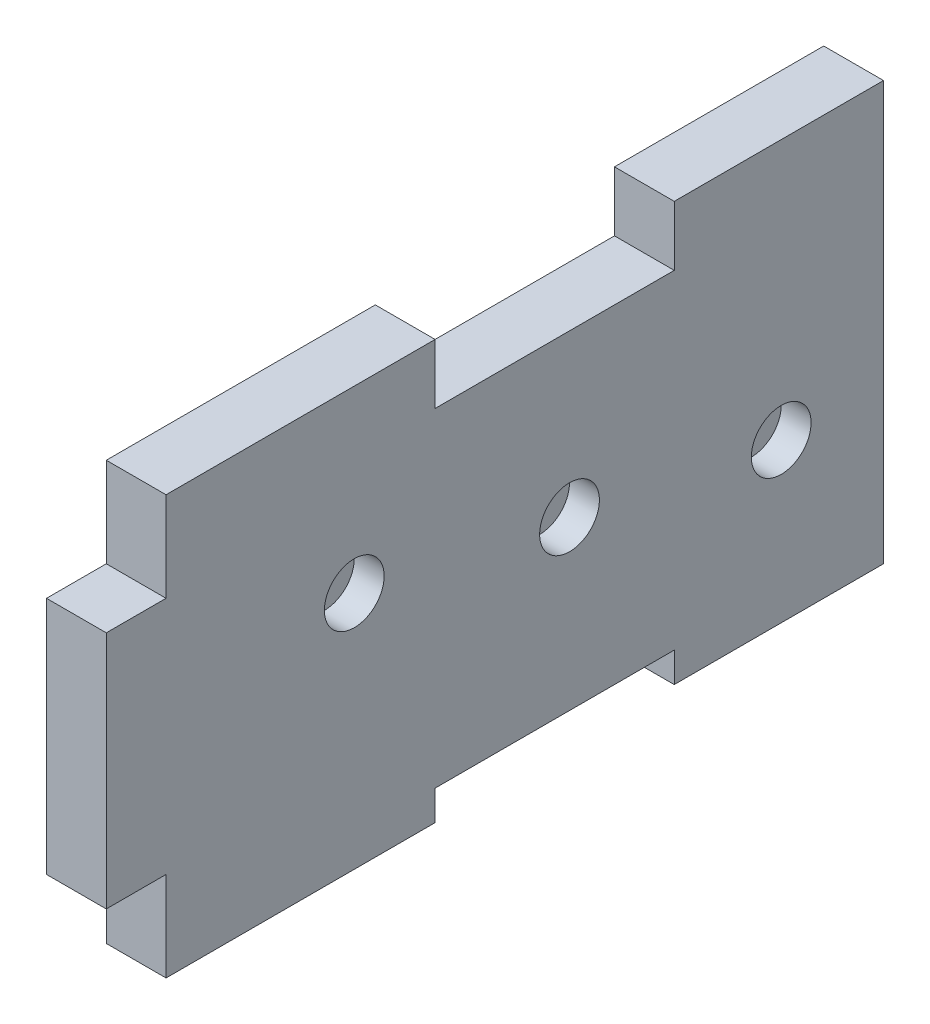
from build123d import *

# Parameters (mm, degrees)
BOSS_EXTRUDE1_DEPTH = 5
SKETCH5_R           = 5
CUT_EXTRUDE4_DEPTH  = 5
SKETCH2_R           = 5
CUT_EXTRUDE5_DEPTH  = 5
BOSS_EXTRUDE2_DEPTH = 5


with BuildPart() as part:
    # Sketch1 → Boss-Extrude1 (new body)
    with BuildSketch(Plane(origin=(0, 0, 0), x_dir=(0, 0, -1), z_dir=(1, 0, 0))):
        Polygon((-75, 70), (-120, 70), (-120, 55), (-130, 55), (-130, 15), (-120, 15), (-120, 0), (-75, 0), (-75, 5), (-35, 5), (-35, 0), (-10, 0), (0, 0), (0, 15), (0, 55), (0, 70), (-10, 70), (-35, 70), (-35, 60), (-75, 60), align=None)
    extrude(amount=BOSS_EXTRUDE1_DEPTH)

    # Sketch5 → Cut-Extrude4 (cut)
    with BuildSketch(Plane.ZY):
        with Locations((17.111667647, 26.5)):
            Circle(SKETCH5_R)
        with Locations((52.52, 33)):
            Circle(SKETCH5_R)
    extrude(amount=-CUT_EXTRUDE4_DEPTH, mode=Mode.SUBTRACT)

    # Sketch2 → Cut-Extrude5 (cut)
    with BuildSketch(Plane(origin=(5, 0, 0), x_dir=(0, 0, -1), z_dir=(1, 0, 0))):
        with Locations((-88.52, 40)):
            Circle(SKETCH2_R)
    extrude(amount=-CUT_EXTRUDE5_DEPTH, mode=Mode.SUBTRACT)

    # Sketch6 → Boss-Extrude2 (add)
    with BuildSketch(Plane.ZY):
        Polygon((35, 0), (35, 5), (75, 5), (75, 0), (120, 0), (120, 15), (130, 15), (130, 55), (120, 55), (120, 70), (75, 70), (75, 60), (35, 60), (35, 70), (0, 70), (0, 0), align=None)
    extrude(amount=BOSS_EXTRUDE2_DEPTH)


solid = part.part
